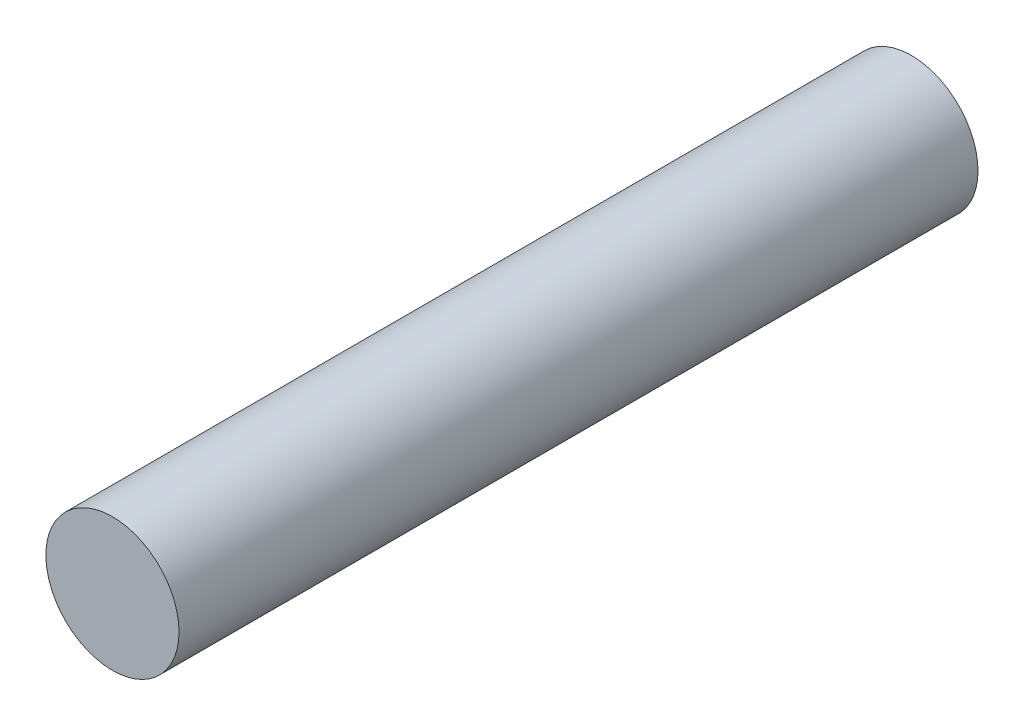
from build123d import *

# Parameters (mm, degrees)
SKETCH1_R           = 2.5
BOSS_EXTRUDE1_DEPTH = 15


with BuildPart() as part:
    # Sketch1 → Boss-Extrude1 (new, symmetric)
    with BuildSketch(Plane.XY):
        Circle(SKETCH1_R)
    extrude(amount=BOSS_EXTRUDE1_DEPTH, both=True)


solid = part.part
